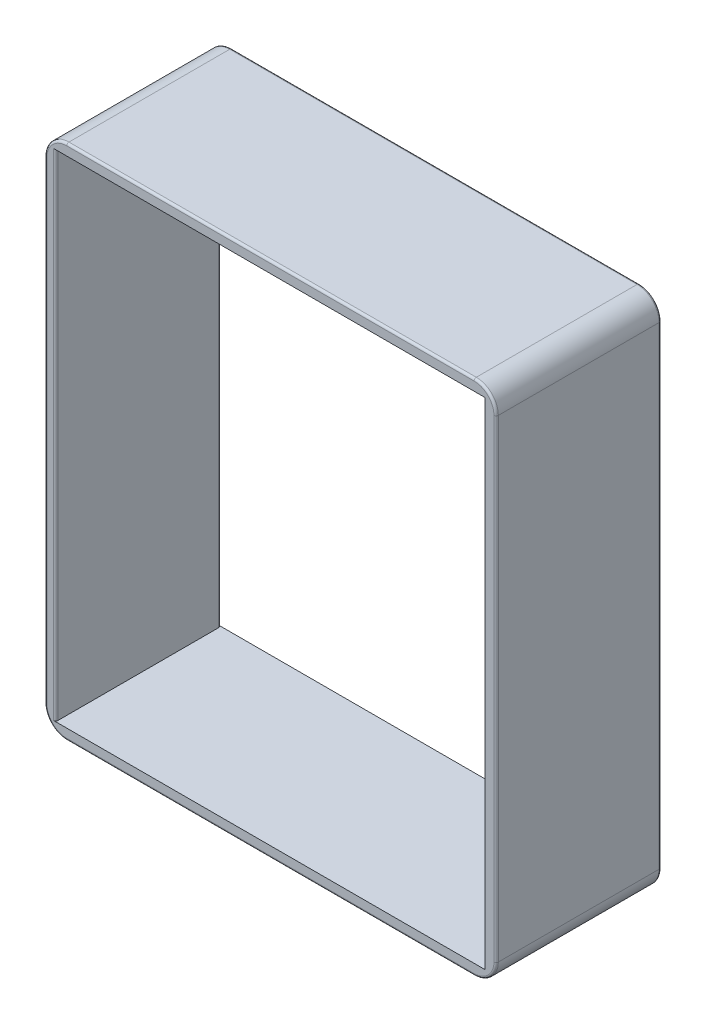
from build123d import *

# Parameters (mm, degrees)
SKETCH1_W           = 41
SKETCH1_H           = 47
SKETCH1_W_2         = 39
SKETCH1_H_2         = 45
BOSS_EXTRUDE1_DEPTH = 15
FILLET1_R           = 2
FILLET4_R           = 0.2


with BuildPart() as part:
    # Sketch1 → Boss-Extrude1 (new body)
    with BuildSketch(Plane.XY):
        Rectangle(SKETCH1_W, SKETCH1_H)
        Rectangle(SKETCH1_W_2, SKETCH1_H_2, mode=Mode.SUBTRACT)
    extrude(amount=BOSS_EXTRUDE1_DEPTH)

    # Fillet1
    fillet1_edges = [part.edges().sort_by_distance(p)[0] for p in [
        (-20.5, -23.5, 7.5),
        (-20.5, 23.5, 7.5),
        (20.5, 23.5, 7.5),
        (20.5, -23.5, 7.5),
    ]]
    fillet(fillet1_edges, radius=FILLET1_R)

    # Fillet4
    fillet4_edges = [part.edges().sort_by_distance(p)[0] for p in [
        (-19.5, 0, 0),
        (-19.5, 0, 15),
        (0, -23.5, 0),
        (0, -23.5, 15),
        (-20.5, 0, 0),
        (0, 23.5, 0),
        (20.5, 0, 0),
        (-19.914213562, 22.914213562, 0),
        (19.914213562, 22.914213562, 0),
        (19.914213562, -22.914213562, 0),
        (-19.914213562, -22.914213562, 0),
        (-20.5, 0, 15),
        (20.5, 0, 15),
        (0, 23.5, 15),
        (-19.914213562, 22.914213562, 15),
        (19.914213562, 22.914213562, 15),
        (19.914213562, -22.914213562, 15),
        (-19.914213562, -22.914213562, 15),
    ]]
    fillet(fillet4_edges, radius=FILLET4_R)


solid = part.part
